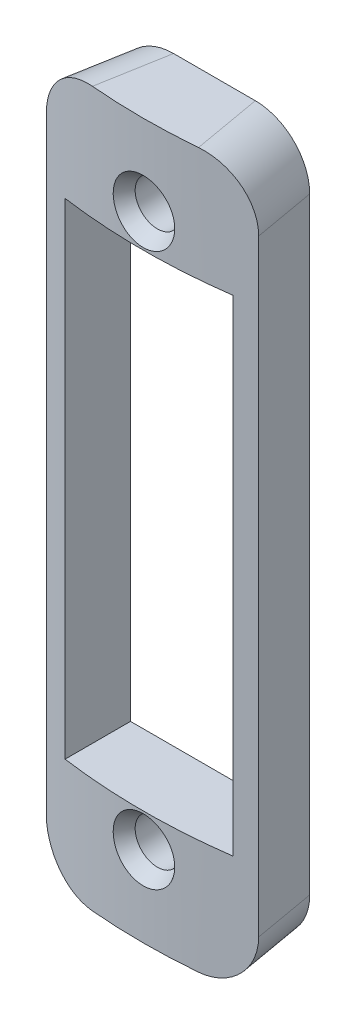
from build123d import *

# Parameters (mm, degrees)
SKETCH1_W                         = 2
SKETCH1_H                         = 40
BULK_EXTRUDE_ANGLE                = 20
CONNECTOR_PASSTHRU_DEPTH          = 41.516317865
CONNECTOR_PASSTHRU_DEPTH_BACK     = 41.516317865
SKETCH2_R                         = 1.25
SKETCH2_W                         = 9.4
SKETCH2_H                         = 27.2
REAR_FLATTENING_REACH             = 42.516
SKETCH3_W                         = 11.20030746
SKETCH3_H                         = 40
SKETCH3_R                         = 1.25
SKETCH3_W_2                       = 9.4
SKETCH3_H_2                       = 27.2
REAR_FLATTENING_DIRECTION_2_DEPTH = 1.5
SKETCH4_W                         = 5.422124609
SKETCH4_H                         = 40
CUT_EXTRUDE2_DEPTH                = 42.810193065
SKETCH5_W                         = 5.376196321
SKETCH5_H                         = 40
CUT_EXTRUDE3_DEPTH                = 42.810193065
FILLET1_R                         = 3


with BuildPart() as part:
    # Sketch1 → BULK EXTRUDE (revolve, symmetric)
    with BuildSketch(Plane(origin=(0, 0, 0), x_dir=(0, 0, -1), z_dir=(1, 0, 0))) as bulk_extrude_sk:
        with Locations((1, 20)):
            Rectangle(SKETCH1_W, SKETCH1_H)
    revolve(axis=Axis((0, 0, -34.25), (0, 1, 0)), revolution_arc=BULK_EXTRUDE_ANGLE / 2)
    revolve(bulk_extrude_sk.sketch, axis=Axis((0, 0, -34.25), (0, -1, 0)), revolution_arc=BULK_EXTRUDE_ANGLE / 2)

    # Sketch2 → CONNECTOR PASSTHRU (cut, two sides: drawn at the far end of the back side and taken through both)
    with BuildSketch(Plane.XY.offset(-CONNECTOR_PASSTHRU_DEPTH_BACK)):
        with Locations((0, 4.52)):
            Circle(SKETCH2_R)
        with Locations((0, 35.48)):
            Circle(SKETCH2_R)
        with Locations((0, 20)):
            Rectangle(SKETCH2_W, SKETCH2_H)
    extrude(amount=CONNECTOR_PASSTHRU_DEPTH + CONNECTOR_PASSTHRU_DEPTH_BACK, mode=Mode.SUBTRACT)

    # Sketch3 → REAR FLATTENING (add, up to next)
    with BuildSketch(Plane.XY.offset(-2.489949965), mode=Mode.PRIVATE) as rear_flattening_sk1:
        with Locations((0, 20)):
            Rectangle(SKETCH3_W, SKETCH3_H)
        with Locations((0, 4.52)):
            Circle(SKETCH3_R, mode=Mode.SUBTRACT)
        with Locations((0, 35.48)):
            Circle(SKETCH3_R, mode=Mode.SUBTRACT)
        with Locations((0, 20)):
            Rectangle(SKETCH3_W_2, SKETCH3_H_2, mode=Mode.SUBTRACT)
    rear_flattening_tool1 = extrude(rear_flattening_sk1.sketch, amount=REAR_FLATTENING_REACH, mode=Mode.PRIVATE) - part.part
    add(rear_flattening_tool1.solids().sort_by_distance((0, 0.415385, -2.48995))[0])

    # Sketch3 → REAR FLATTENING direction 2 (add)
    with BuildSketch(Plane.XY.offset(-2.489949965)):
        with Locations((0, 20)):
            Rectangle(SKETCH3_W, SKETCH3_H)
        with Locations((0, 4.52)):
            Circle(SKETCH3_R, mode=Mode.SUBTRACT)
        with Locations((0, 35.48)):
            Circle(SKETCH3_R, mode=Mode.SUBTRACT)
        with Locations((0, 20)):
            Rectangle(SKETCH3_W_2, SKETCH3_H_2, mode=Mode.SUBTRACT)
    extrude(amount=-REAR_FLATTENING_DIRECTION_2_DEPTH)

    # Sketch4 → Cut-Extrude2 (cut, through all)
    with BuildSketch(Plane(origin=(5.857094954, 0, -1.032763869), x_dir=(-0.17364817766693075, 0, -0.9848077530122081), z_dir=(0.9848077530122081, 0, -0.17364817766693075))):
        with Locations((2.190727846, 20)):
            Rectangle(SKETCH4_W, SKETCH4_H)
    extrude(amount=CUT_EXTRUDE2_DEPTH, mode=Mode.SUBTRACT)

    # Sketch5 → Cut-Extrude3 (cut, through all)
    with BuildSketch(Plane(origin=(-5.857094954, 0, -1.032763869), x_dir=(-0.17364817766693072, 0, 0.9848077530122081), z_dir=(-0.9848077530122081, 0, -0.17364817766693072))):
        with Locations((-2.167763702, 20)):
            Rectangle(SKETCH5_W, SKETCH5_H)
    extrude(amount=CUT_EXTRUDE3_DEPTH, mode=Mode.SUBTRACT)

    # Fillet1
    fillet1_edges = [part.edges().sort_by_distance(p)[0] for p in [
        (5.641556672, 40, -2.255142212),
        (5.641556672, 0, -2.255142212),
        (-5.641556672, 0, -2.255142212),
        (-5.641556672, 40, -2.255142212),
    ]]
    fillet(fillet1_edges, radius=FILLET1_R)

    # Sketch6 → Cut-Revolve1 (revolve, cut)
    with BuildSketch(Plane.ZY):
        Polygon((0, 4.52), (0, 6.27), (-1, 5.645), (-1, 4.52), align=None)
    cut_revolve1 = revolve(axis=Axis((0, 4.52, -3.989949965), (0, 0, 1)), mode=Mode.SUBTRACT)

    # Mirror1: Cut-Revolve1 across plane
    add(cut_revolve1.mirror(Plane.ZX.offset(20)), mode=Mode.SUBTRACT)


solid = part.part
